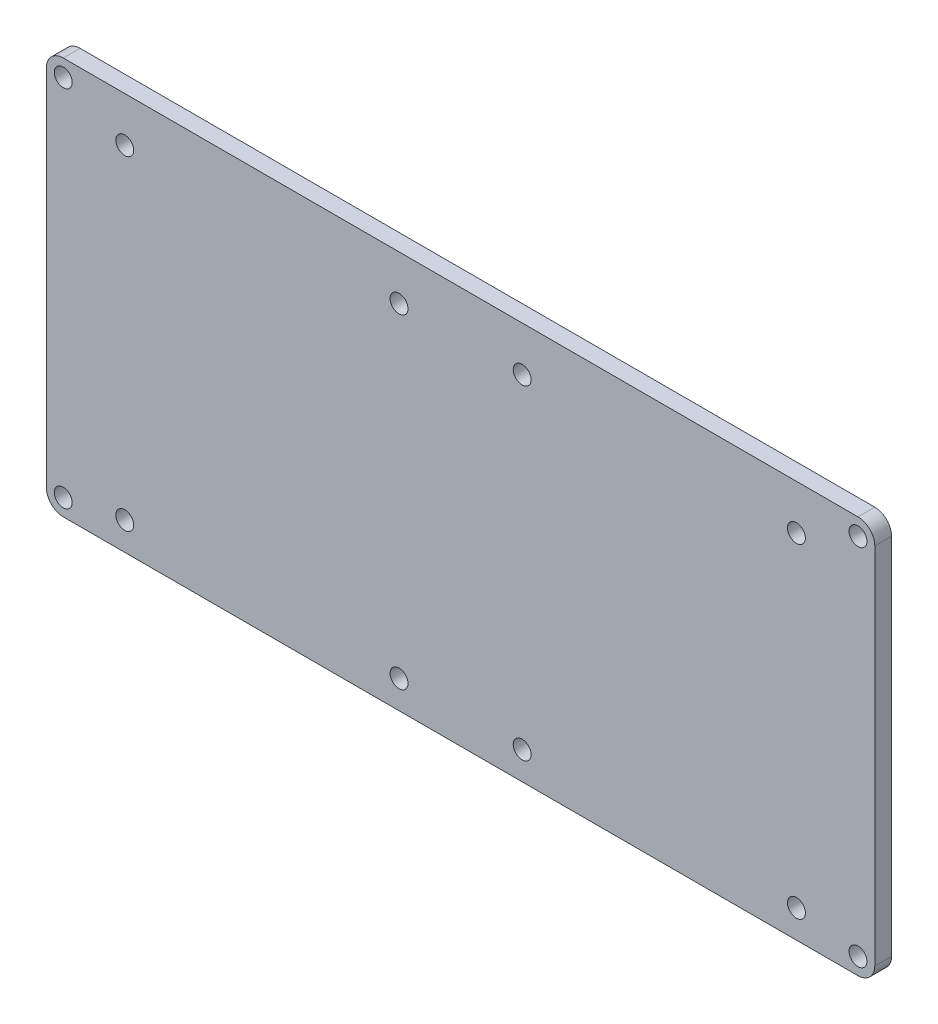
from build123d import *

# Parameters (mm, degrees)
SKETCH_1_R      = 1.6
EXTRUDE_1_DEPTH = 3


with BuildPart() as part:
    # 草图1 → 凸台-拉伸1 (new body)
    with BuildSketch(Plane.XY):
        with BuildLine():
            Line((3, 0), (145, 0))
            ThreePointArc((145, 0), (147.121320344, 0.878679656), (148, 3))
            Line((148, 3), (148, 68))
            ThreePointArc((148, 68), (147.121320344, 70.121320344), (145, 71))
            Line((145, 71), (3, 71))
            ThreePointArc((3, 71), (0.878679656, 70.121320344), (0, 68))
            Line((0, 68), (0, 3))
            ThreePointArc((0, 3), (0.878679656, 0.878679656), (3, 0))
        make_face()
        with Locations((3, 3)):
            Circle(SKETCH_1_R, mode=Mode.SUBTRACT)
        with Locations((145, 3)):
            Circle(SKETCH_1_R, mode=Mode.SUBTRACT)
        with Locations((145, 68)):
            Circle(SKETCH_1_R, mode=Mode.SUBTRACT)
        with Locations((3, 68)):
            Circle(SKETCH_1_R, mode=Mode.SUBTRACT)
        with Locations((14, 63)):
            Circle(SKETCH_1_R, mode=Mode.SUBTRACT)
        with Locations((63, 63)):
            Circle(SKETCH_1_R, mode=Mode.SUBTRACT)
        with Locations((63, 5)):
            Circle(SKETCH_1_R, mode=Mode.SUBTRACT)
        with Locations((14, 5)):
            Circle(SKETCH_1_R, mode=Mode.SUBTRACT)
        with Locations(Location((85, 63, 0), (0, 0, 180))):
            Circle(SKETCH_1_R, mode=Mode.SUBTRACT)
        with Locations(Location((85, 5, 0), (0, 0, 180))):
            Circle(SKETCH_1_R, mode=Mode.SUBTRACT)
        with Locations(Location((134, 5, 0), (0, 0, 180))):
            Circle(SKETCH_1_R, mode=Mode.SUBTRACT)
        with Locations(Location((134, 63, 0), (0, 0, 180))):
            Circle(SKETCH_1_R, mode=Mode.SUBTRACT)
    extrude(amount=EXTRUDE_1_DEPTH)


solid = part.part
